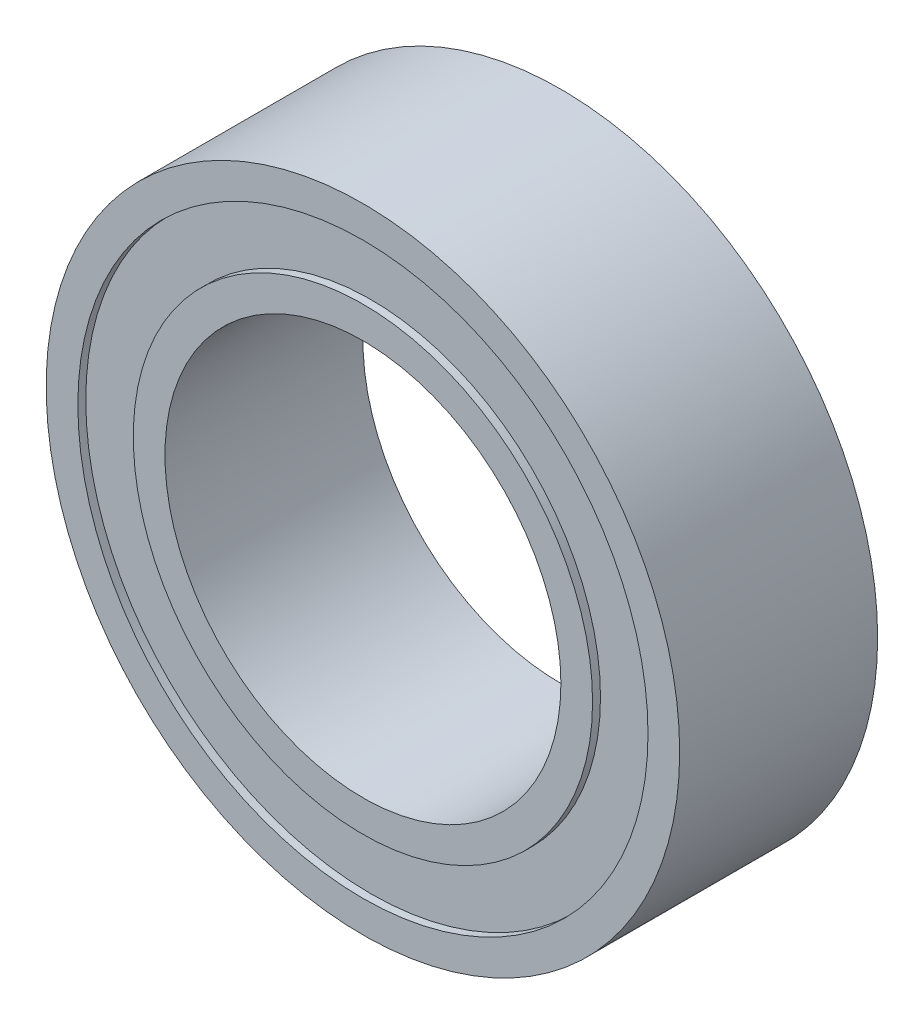
from build123d import *

# Parameters (mm, degrees)
SKETCH1_R          = 2.9
SKETCH1_R_2        = 2.5
EXTRUSION1_DEPTH   = 2.5
SKETCH1_R_3        = 4
SKETCH1_R_4        = 3.6
EXTRUSION1_2_DEPTH = 2.5
SKETCH2_R          = 3.6
SKETCH2_R_2        = 2.9
EXTRUSION2_DEPTH   = 2.2


with BuildPart() as part:
    # Sketch1 → Extrusion1 (new body)
    with BuildSketch(Plane.XY):
        Circle(SKETCH1_R)
        Circle(SKETCH1_R_2, mode=Mode.SUBTRACT)
    extrude(amount=EXTRUSION1_DEPTH)



with BuildPart() as body_2:
    # Sketch1 → Extrusion1 2 (new body)
    with BuildSketch(Plane.XY):
        Circle(SKETCH1_R_3)
        Circle(SKETCH1_R_4, mode=Mode.SUBTRACT)
    extrude(amount=EXTRUSION1_2_DEPTH)


with BuildPart() as part_1:
    add(part.part)

    add(body_2.part)  # Extrusion2 merges body 2
    # Sketch2 → Extrusion2 (add)
    with BuildSketch(Plane.XY.offset(0.2)):
        Circle(SKETCH2_R)
        Circle(SKETCH2_R_2, mode=Mode.SUBTRACT)
    extrude(amount=EXTRUSION2_DEPTH)


solid = part_1.part
